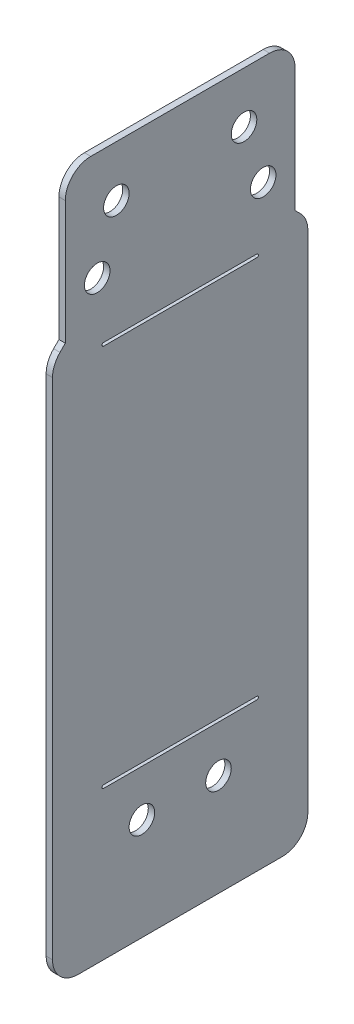
from build123d import *

# Parameters (mm, degrees)
SKETCH1_W                = 36
SKETCH1_H                = 110
BOSS_EXTRUDE1_DEPTH      = 1
F_4_0_4_DIAMETER_HOLE2_D = 4
F_4_0_4_DIAMETER_HOLE3_D = 4
F_4_0_4_DIAMETER_HOLE1_D = 4
BOSS_EXTRUDE2_DEPTH      = 1
FILLET1_R                = 4
CUT_EXTRUDE1_DEPTH       = 112.807870922
FILLET2_R                = 4


with BuildPart() as part:
    # Sketch1 → Boss-Extrude1 (new body)
    with BuildSketch(Plane(origin=(0, 0, 0), x_dir=(0, 0, -1), z_dir=(1, 0, 0))):
        with Locations((0, -55)):
            Rectangle(SKETCH1_W, SKETCH1_H)
    extrude(amount=BOSS_EXTRUDE1_DEPTH)

    # Ø4.0 (4) Diameter Hole2 (through all)
    with Locations(Plane.ZY):
        with Locations((-10, -8), (10, -8)):
            Hole(F_4_0_4_DIAMETER_HOLE2_D / 2)

    # Ø4.0 (4) Diameter Hole3 (through all)
    with Locations(Plane.ZY):
        with Locations((-13, -17), (13, -17)):
            Hole(F_4_0_4_DIAMETER_HOLE3_D / 2)

    # Ø4.0 (4) Diameter Hole1 (through all)
    with Locations(Plane(origin=(1, 0, 0), x_dir=(0, 0, -1), z_dir=(1, 0, 0))):
        with Locations((6, -94), (-6, -94)):
            Hole(F_4_0_4_DIAMETER_HOLE1_D / 2)

    # Sketch9 → Boss-Extrude2 (add)
    with BuildSketch(Plane.ZY):
        Polygon((18, -23.35), (20, -25.35), (20, -110), (18, -110), align=None)
        Polygon((-18, -23.35), (-20, -25.35), (-20, -110), (-18, -110), align=None)
    extrude(amount=-BOSS_EXTRUDE2_DEPTH)

    # Fillet1
    fillet1_edges = [part.edges().sort_by_distance(p)[0] for p in [
        (0.5, 0, 18),
        (0.5, 0, -18),
    ]]
    fillet(fillet1_edges, radius=FILLET1_R)

    # Sketch10 → Cut-Extrude1 (cut, through all)
    with BuildSketch(Plane.ZY):
        with BuildLine():
            Line((12, -86.75), (-12, -86.75))
            ThreePointArc((-12, -86.75), (-12.25, -86.5), (-12, -86.25))
            Line((-12, -86.25), (12, -86.25))
            ThreePointArc((12, -86.25), (12.25, -86.5), (12, -86.75))
        make_face()
        with BuildLine():
            Line((12, -26.75), (-12, -26.75))
            ThreePointArc((-12, -26.75), (-12.25, -26.5), (-12, -26.25))
            Line((-12, -26.25), (12, -26.25))
            ThreePointArc((12, -26.25), (12.25, -26.5), (12, -26.75))
        make_face()
    extrude(amount=-CUT_EXTRUDE1_DEPTH, mode=Mode.SUBTRACT)

    # Fillet2
    fillet2_edges = [part.edges().sort_by_distance(p)[0] for p in [
        (0.5, -25.35, 20),
        (0.5, -110, 20),
        (0.5, -110, -20),
        (0.5, -25.35, -20),
    ]]
    fillet(fillet2_edges, radius=FILLET2_R)


solid = part.part
